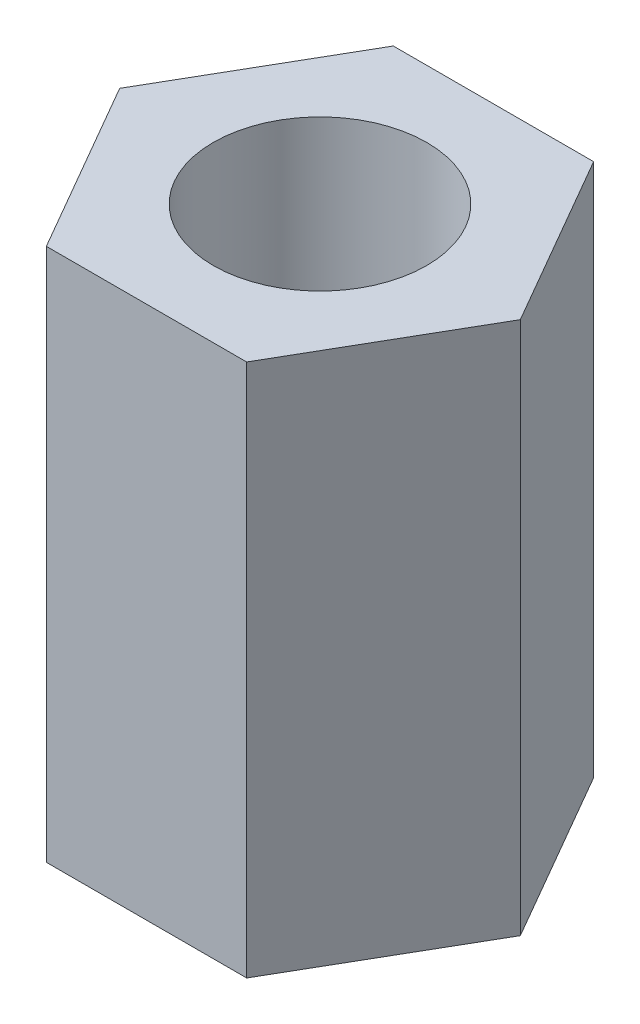
from build123d import *

# Parameters (mm, degrees)
SKETCH1_R           = 4
BOSS_EXTRUDE1_DEPTH = 10


with BuildPart() as part:
    # Sketch1 → Boss-Extrude1 (new, symmetric)
    with BuildSketch(Plane(origin=(0, 0, 0), x_dir=(1, 0, 0), z_dir=(0, 1, 0))):
        Polygon((3.755, 6.503850782), (-3.755, 6.503850782), (-7.51, 0), (-3.755, -6.503850782), (3.755, -6.503850782), (7.51, 0), align=None)
        with Locations(Location((0, 0, 0), (0, 0, 270))):
            Circle(SKETCH1_R, mode=Mode.SUBTRACT)
    extrude(amount=BOSS_EXTRUDE1_DEPTH, both=True)


solid = part.part
